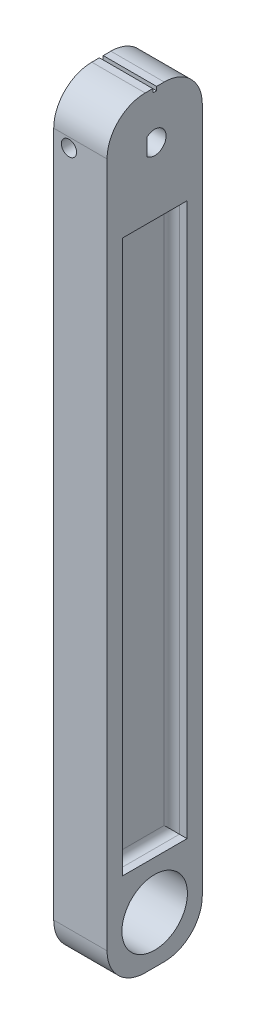
from build123d import *

# Parameters (mm, degrees)
CROQUIS1_W              = 14
CROQUIS1_H              = 25
SALIENTE_EXTRUIR1_DEPTH = 200
REDONDEO1_R             = 10
REDONDEO2_R             = 10
CROQUIS2_R              = 8.6
CORTAR_EXTRUIR1_DEPTH   = 28
CROQUIS14_R             = 9.913044
SALIENTE_EXTRUIR2_DEPTH = 14
CROQUIS12_R             = 2
CORTAR_EXTRUIR7_DEPTH   = 203.042074826
CROQUIS15_W             = 3
CROQUIS15_H             = 5.6
CORTAR_EXTRUIR9_DEPTH   = 8
CROQUIS16_W             = 17
CROQUIS16_H             = 145
CORTAR_EXTRUIR10_DEPTH  = 4
CROQUIS17_W             = 17
CROQUIS17_H             = 145
CORTAR_EXTRUIR11_DEPTH  = 4
REDONDEO5_R             = 2
REDONDEO6_R             = 2
CROQUIS18_W             = 1
CROQUIS18_H             = 1
CORTAR_EXTRUIR12_DEPTH  = 203.042074845
REDONDEO9_R             = 10
REDONDEO10_R            = 10


with BuildPart() as part:
    # Croquis1 → Saliente-Extruir1 (new body)
    with BuildSketch(Plane(origin=(0, 0, 0), x_dir=(1, 0, 0), z_dir=(0, 1, 0))):
        with Locations((7, 12.5)):
            Rectangle(CROQUIS1_W, CROQUIS1_H)
    extrude(amount=SALIENTE_EXTRUIR1_DEPTH)

    # Redondeo1
    redondeo1_edges = [part.edges().sort_by_distance(p)[0] for p in [
        (7, 0, -25),
    ]]
    fillet(redondeo1_edges, radius=REDONDEO1_R)

    # Redondeo2
    redondeo2_edges = [part.edges().sort_by_distance(p)[0] for p in [
        (7, 0, 0),
    ]]
    fillet(redondeo2_edges, radius=REDONDEO2_R)

    # Croquis2 → Cortar-Extruir1 (cut)
    with BuildSketch(Plane(origin=(14, 0, 0), x_dir=(0, 0, -1), z_dir=(1, 0, 0))):
        with Locations((12.5, 12.5)):
            Circle(CROQUIS2_R)
        with BuildLine():
            Line((10.5, 185.263932023), (10.5, 189.736067977))
            ThreePointArc((10.5, 189.736067977), (15.5, 187.5), (10.5, 185.263932023))
        make_face()
    extrude(amount=-CORTAR_EXTRUIR1_DEPTH, mode=Mode.SUBTRACT)

    # Croquis14 → Saliente-Extruir2 (add)
    with BuildSketch(Plane(origin=(14, 0, 0), x_dir=(0, 0, -1), z_dir=(1, 0, 0))):
        with Locations((12.5, 187.5)):
            Circle(CROQUIS14_R)
        with BuildLine():
            Line((10.5, 185.263932023), (10.5, 189.736067977))
            ThreePointArc((10.5, 189.736067977), (15.5, 187.5), (10.5, 185.263932023))
        make_face(mode=Mode.SUBTRACT)
    extrude(amount=-SALIENTE_EXTRUIR2_DEPTH)

    # Croquis12 → Cortar-Extruir7 (cut, through all)
    with BuildSketch(Plane(origin=(0, 0, -25), x_dir=(-1, 0, 0), z_dir=(0, 0, -1))):
        with Locations((-4, 187.5)):
            Circle(CROQUIS12_R)
    extrude(amount=-CORTAR_EXTRUIR7_DEPTH, mode=Mode.SUBTRACT)

    # Croquis15 → Cortar-Extruir9 (cut)
    with BuildSketch(Plane.ZY):
        with Locations((-6.582205818, 187.5)):
            Rectangle(CROQUIS15_W, CROQUIS15_H)
    extrude(amount=-CORTAR_EXTRUIR9_DEPTH, mode=Mode.SUBTRACT)

    # Croquis16 → Cortar-Extruir10 (cut)
    with BuildSketch(Plane.ZY):
        with Locations((-12.5, 97.5)):
            Rectangle(CROQUIS16_W, CROQUIS16_H)
    extrude(amount=-CORTAR_EXTRUIR10_DEPTH, mode=Mode.SUBTRACT)

    # Croquis17 → Cortar-Extruir11 (cut)
    with BuildSketch(Plane(origin=(14, 0, 0), x_dir=(0, 0, -1), z_dir=(1, 0, 0))):
        with Locations((12.5, 97.5)):
            Rectangle(CROQUIS17_W, CROQUIS17_H)
    extrude(amount=-CORTAR_EXTRUIR11_DEPTH, mode=Mode.SUBTRACT)

    # Redondeo5
    redondeo5_edges = [part.edges().sort_by_distance(p)[0] for p in [
        (4, 97.5, -21),
        (4, 170, -12.5),
        (4, 97.5, -4),
        (4, 25, -12.5),
    ]]
    fillet(redondeo5_edges, radius=REDONDEO5_R)

    # Redondeo6
    redondeo6_edges = [part.edges().sort_by_distance(p)[0] for p in [
        (10, 97.5, -21),
        (10, 25, -12.5),
        (10, 97.5, -4),
        (10, 170, -12.5),
    ]]
    fillet(redondeo6_edges, radius=REDONDEO6_R)

    # Croquis18 → Cortar-Extruir12 (cut, through all)
    with BuildSketch(Plane(origin=(14, 0, 0), x_dir=(0, 0, -1), z_dir=(1, 0, 0))):
        with Locations((12.5, 199.5)):
            Rectangle(CROQUIS18_W, CROQUIS18_H)
    extrude(amount=-CORTAR_EXTRUIR12_DEPTH, mode=Mode.SUBTRACT)

    # Redondeo9
    redondeo9_edges = [part.edges().sort_by_distance(p)[0] for p in [
        (7, 200, 0),
    ]]
    fillet(redondeo9_edges, radius=REDONDEO9_R)

    # Redondeo10
    redondeo10_edges = [part.edges().sort_by_distance(p)[0] for p in [
        (7, 200, -25),
    ]]
    fillet(redondeo10_edges, radius=REDONDEO10_R)


solid = part.part
